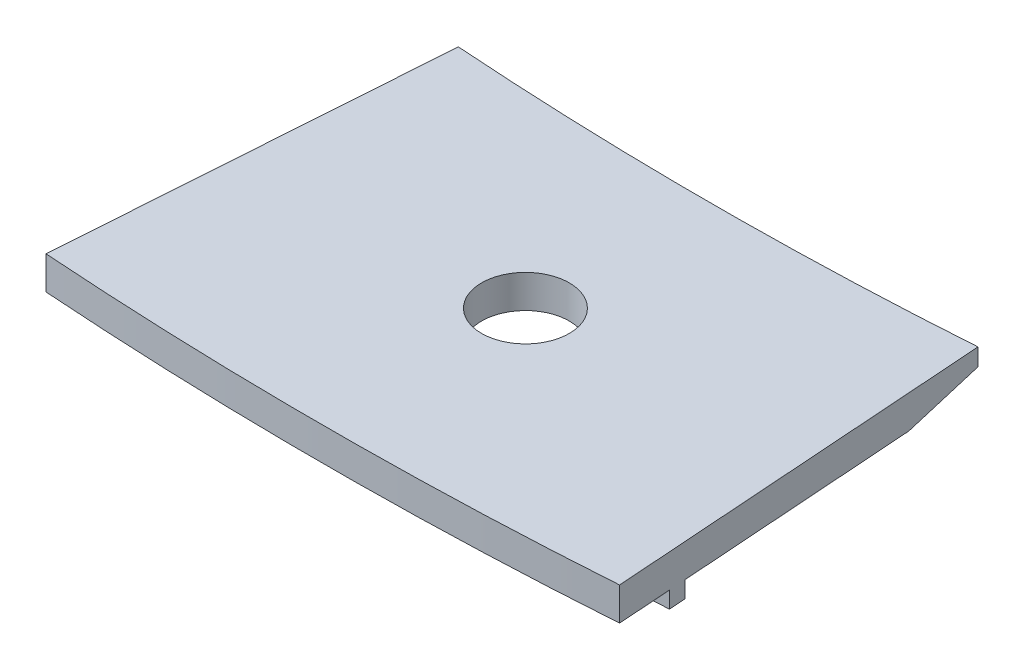
from build123d import *

# Parameters (mm, degrees)
SKETCH2_R           = 2.65
BOSS_EXTRUDE1_DEPTH = 2
BOSS_EXTRUDE2_DEPTH = 2
CHAMFER1_SIZE       = 4.5
CHAMFER1_SIZE2      = 0.956504528
BOSS_EXTRUDE3_DEPTH = 1


with BuildPart() as part:
    # Sketch2 → Boss-Extrude1 (new body)
    with BuildSketch(Plane(origin=(0, 0, 0), x_dir=(1, 0, 0), z_dir=(0, 1, 0))):
        with BuildLine():
            Line((-15.984695958, -228.591802117), (-17.334483725, -247.89466649))
            ThreePointArc((-17.334483725, -247.89466649), (0, -248.5), (17.334483725, -247.89466649))
            Line((17.334483725, -247.89466649), (15.984695958, -228.591802117))
            ThreePointArc((15.984695958, -228.591802117), (0, -229.15), (-15.984695958, -228.591802117))
        make_face()
        with Locations(Location((0, -236.25, 0), (0, 0, 270))):
            Circle(SKETCH2_R, mode=Mode.SUBTRACT)
    extrude(amount=BOSS_EXTRUDE1_DEPTH)

    # Sketch3 → Boss-Extrude2 (add)
    with BuildSketch(Plane(origin=(0, 0, 0), x_dir=(1, 0, 0), z_dir=(0, 1, 0))):
        with BuildLine():
            Line((-15.705670063, -224.601545916), (-15.984695958, -228.591802117))
            ThreePointArc((-15.984695958, -228.591802117), (0, -229.15), (15.984695958, -228.591802117))
            Line((15.984695958, -228.591802117), (15.705670063, -224.601545916))
            ThreePointArc((15.705670063, -224.601545916), (0, -225.15), (-15.705670063, -224.601545916))
        make_face()
    extrude(amount=BOSS_EXTRUDE2_DEPTH)

    # Chamfer1
    chamfer1_edges = [part.edges().sort_by_distance(p)[0] for p in [
        (0, 0, 225.15),
    ]]
    chamfer1_side = [part.faces().sort_by_distance(p)[0] for p in [
        (0, 0, 248.078921217),
    ]]
    chamfer(chamfer1_edges, length=CHAMFER1_SIZE, length2=CHAMFER1_SIZE2, reference=chamfer1_side[0])

    # Sketch4 → Boss-Extrude3 (add)
    with BuildSketch(Plane.XZ):
        with BuildLine():
            Line((-17.107945524, 244.655019276), (-17.038018712, 243.655019276))
            ThreePointArc((-17.038018712, 243.655019276), (0, 244.25), (17.038018712, 243.655019276))
            Line((17.038018712, 243.655019276), (17.107945524, 244.655019276))
            ThreePointArc((17.107945524, 244.655019276), (0, 245.252441898), (-17.107945524, 244.655019276))
        make_face()
    extrude(amount=BOSS_EXTRUDE3_DEPTH)


solid = part.part
